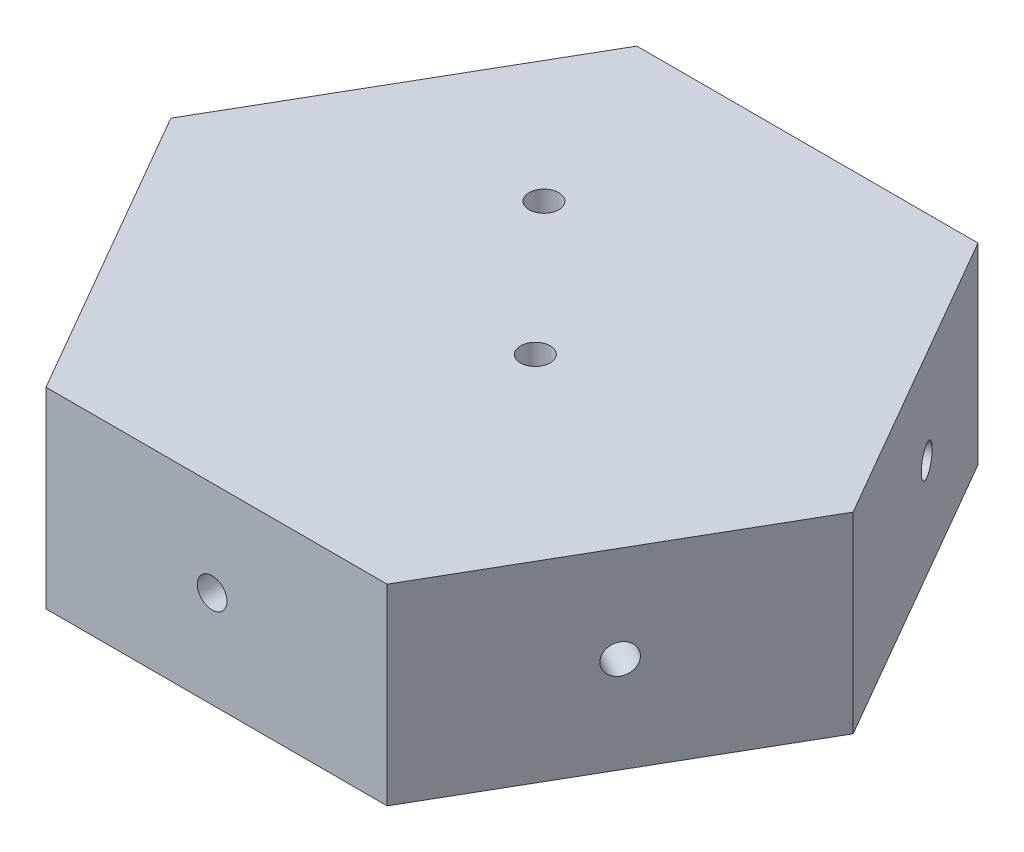
from build123d import *

# Parameters (mm, degrees)
BOSS_EXTRUDE1_DEPTH                   = 16.51
F_1_4_20_TAPPED_HOLE2_D               = 5.1054
F_1_4_20_TAPPED_HOLE2_DEPTH           = 16.51
F_1_4_20_TAPPED_HOLE2_TIP             = 1.533816902
F_1_4_20_TAPPED_HOLE2_ON_FACE_2_D     = 5.1054
F_1_4_20_TAPPED_HOLE2_ON_FACE_2_DEPTH = 16.51
F_1_4_20_TAPPED_HOLE2_ON_FACE_2_TIP   = 1.533816902
F_1_4_20_TAPPED_HOLE2_ON_FACE_3_D     = 5.1054
F_1_4_20_TAPPED_HOLE2_ON_FACE_3_DEPTH = 16.51
F_1_4_20_TAPPED_HOLE2_ON_FACE_3_TIP   = 1.533816902
F_1_4_20_TAPPED_HOLE2_ON_FACE_4_D     = 5.1054
F_1_4_20_TAPPED_HOLE2_ON_FACE_4_DEPTH = 16.51
F_1_4_20_TAPPED_HOLE2_ON_FACE_4_TIP   = 1.533816902
F_1_4_20_TAPPED_HOLE2_ON_FACE_5_D     = 5.1054
F_1_4_20_TAPPED_HOLE2_ON_FACE_5_DEPTH = 16.51
F_1_4_20_TAPPED_HOLE2_ON_FACE_5_TIP   = 1.533816902
F_1_4_20_TAPPED_HOLE2_ON_FACE_6_D     = 5.1054
F_1_4_20_TAPPED_HOLE2_ON_FACE_6_DEPTH = 16.51
F_1_4_20_TAPPED_HOLE2_ON_FACE_6_TIP   = 1.533816902
F_1_4_20_TAPPED_HOLE2_ON_FACE_7_D     = 5.1054
F_1_4_20_TAPPED_HOLE2_ON_FACE_7_DEPTH = 16.51
F_1_4_20_TAPPED_HOLE2_ON_FACE_7_TIP   = 1.533816902


with BuildPart() as part:
    # Sketch1 → Boss-Extrude1 (new, symmetric)
    with BuildSketch(Plane(origin=(0, 0, 0), x_dir=(1, 0, 0), z_dir=(0, 1, 0))):
        Polygon((-58.65878735, 0), (-29.329393675, -50.8), (29.329393675, -50.8), (58.65878735, 0), (29.329393675, 50.8), (-29.329393675, 50.8), align=None)
    extrude(amount=BOSS_EXTRUDE1_DEPTH, both=True)

    # 1/4-20 Tapped Hole2
    with Locations(Plane(origin=(-14.225163033, 16.51, -19.717380526), x_dir=(0, 0, 1), z_dir=(0, 1, 0))):
        with Locations((0, 0), (23.5570377, 22.079652882)):
            Hole(F_1_4_20_TAPPED_HOLE2_D / 2, depth=F_1_4_20_TAPPED_HOLE2_DEPTH)
            with Locations((0, 0, -(F_1_4_20_TAPPED_HOLE2_DEPTH + F_1_4_20_TAPPED_HOLE2_TIP / 2))):  # 118° drill point
                Cone(0, F_1_4_20_TAPPED_HOLE2_D / 2, F_1_4_20_TAPPED_HOLE2_TIP, mode=Mode.SUBTRACT)

    # 1/4-20 Tapped Hole2 on face 2
    with Locations(Plane(origin=(41.36951867, 0.562395416, -29.945891779), x_dir=(0.500000174844, 0, 0.866025302838), z_dir=(0.866025302838, 0, -0.500000174844))):
        with Locations((0, 0)):
            Hole(F_1_4_20_TAPPED_HOLE2_ON_FACE_2_D / 2, depth=F_1_4_20_TAPPED_HOLE2_ON_FACE_2_DEPTH)
            with Locations((0, 0, -(F_1_4_20_TAPPED_HOLE2_ON_FACE_2_DEPTH + F_1_4_20_TAPPED_HOLE2_ON_FACE_2_TIP / 2))):  # 118° drill point
                Cone(0, F_1_4_20_TAPPED_HOLE2_ON_FACE_2_D / 2, F_1_4_20_TAPPED_HOLE2_ON_FACE_2_TIP, mode=Mode.SUBTRACT)

    # 1/4-20 Tapped Hole2 on face 3
    with Locations(Plane(origin=(43.994090512, 0, 25.4), x_dir=(-0.500000174844, 0, 0.866025302838), z_dir=(0.866025302838, 0, 0.500000174844))):
        with Locations((0, 0)):
            Hole(F_1_4_20_TAPPED_HOLE2_ON_FACE_3_D / 2, depth=F_1_4_20_TAPPED_HOLE2_ON_FACE_3_DEPTH)
            with Locations((0, 0, -(F_1_4_20_TAPPED_HOLE2_ON_FACE_3_DEPTH + F_1_4_20_TAPPED_HOLE2_ON_FACE_3_TIP / 2))):  # 118° drill point
                Cone(0, F_1_4_20_TAPPED_HOLE2_ON_FACE_3_D / 2, F_1_4_20_TAPPED_HOLE2_ON_FACE_3_TIP, mode=Mode.SUBTRACT)

    # 1/4-20 Tapped Hole2 on face 4
    with Locations(Plane(origin=(-0.767217268, 0.17198146, 50.8), x_dir=(1, 0, 0), z_dir=(0, 0, 1))):
        with Locations((0, 0)):
            Hole(F_1_4_20_TAPPED_HOLE2_ON_FACE_4_D / 2, depth=F_1_4_20_TAPPED_HOLE2_ON_FACE_4_DEPTH)
            with Locations((0, 0, -(F_1_4_20_TAPPED_HOLE2_ON_FACE_4_DEPTH + F_1_4_20_TAPPED_HOLE2_ON_FACE_4_TIP / 2))):  # 118° drill point
                Cone(0, F_1_4_20_TAPPED_HOLE2_ON_FACE_4_D / 2, F_1_4_20_TAPPED_HOLE2_ON_FACE_4_TIP, mode=Mode.SUBTRACT)

    # 1/4-20 Tapped Hole2 on face 5
    with Locations(Plane(origin=(-38.190702716, -1.730660851, 35.451762519), x_dir=(-0.500000174844, 0, -0.866025302838), z_dir=(-0.866025302838, 0, 0.500000174844))):
        with Locations((0, 0)):
            Hole(F_1_4_20_TAPPED_HOLE2_ON_FACE_5_D / 2, depth=F_1_4_20_TAPPED_HOLE2_ON_FACE_5_DEPTH)
            with Locations((0, 0, -(F_1_4_20_TAPPED_HOLE2_ON_FACE_5_DEPTH + F_1_4_20_TAPPED_HOLE2_ON_FACE_5_TIP / 2))):  # 118° drill point
                Cone(0, F_1_4_20_TAPPED_HOLE2_ON_FACE_5_D / 2, F_1_4_20_TAPPED_HOLE2_ON_FACE_5_TIP, mode=Mode.SUBTRACT)

    # 1/4-20 Tapped Hole2 on face 6
    with Locations(Plane(origin=(-48.031402305, -4.745159271, -18.407170849), x_dir=(0.500000174844, 0, -0.866025302838), z_dir=(-0.866025302838, 0, -0.500000174844))):
        with Locations((0, 0)):
            Hole(F_1_4_20_TAPPED_HOLE2_ON_FACE_6_D / 2, depth=F_1_4_20_TAPPED_HOLE2_ON_FACE_6_DEPTH)
            with Locations((0, 0, -(F_1_4_20_TAPPED_HOLE2_ON_FACE_6_DEPTH + F_1_4_20_TAPPED_HOLE2_ON_FACE_6_TIP / 2))):  # 118° drill point
                Cone(0, F_1_4_20_TAPPED_HOLE2_ON_FACE_6_D / 2, F_1_4_20_TAPPED_HOLE2_ON_FACE_6_TIP, mode=Mode.SUBTRACT)

    # 1/4-20 Tapped Hole2 on face 7
    with Locations(Plane(origin=(3.490061769, -2.916627308, -50.8), x_dir=(-1, 0, 0), z_dir=(0, 0, -1))):
        with Locations((0, 0)):
            Hole(F_1_4_20_TAPPED_HOLE2_ON_FACE_7_D / 2, depth=F_1_4_20_TAPPED_HOLE2_ON_FACE_7_DEPTH)
            with Locations((0, 0, -(F_1_4_20_TAPPED_HOLE2_ON_FACE_7_DEPTH + F_1_4_20_TAPPED_HOLE2_ON_FACE_7_TIP / 2))):  # 118° drill point
                Cone(0, F_1_4_20_TAPPED_HOLE2_ON_FACE_7_D / 2, F_1_4_20_TAPPED_HOLE2_ON_FACE_7_TIP, mode=Mode.SUBTRACT)


solid = part.part
